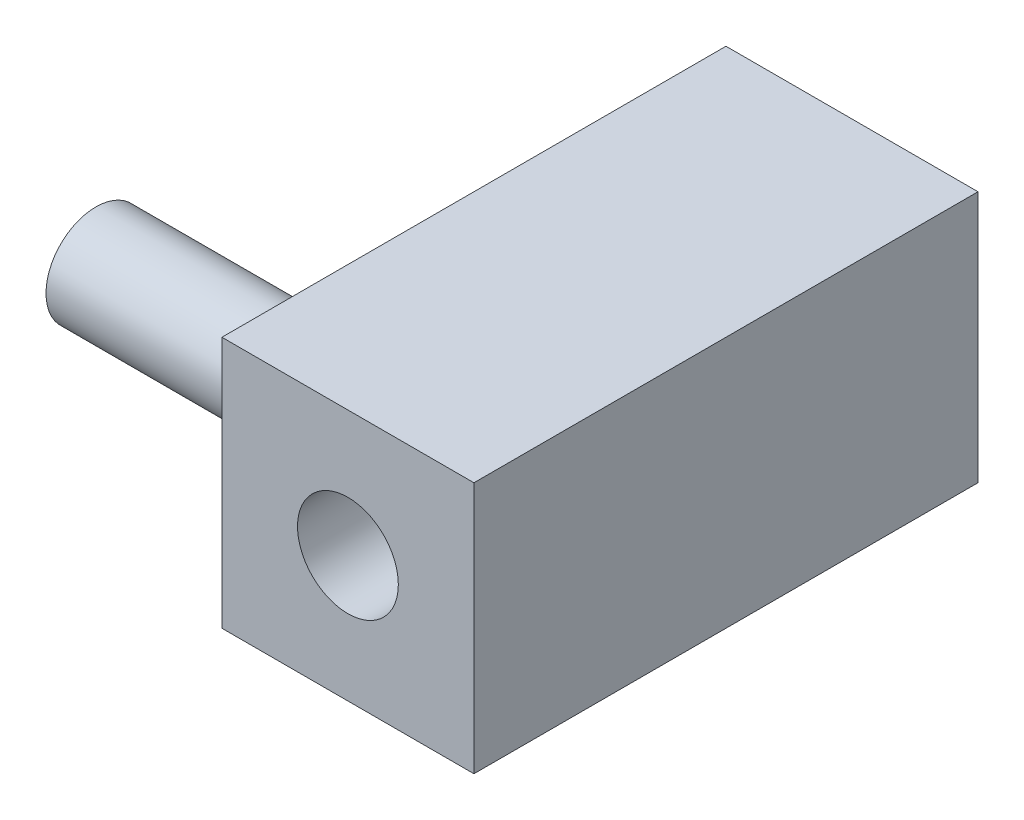
from build123d import *

# Parameters (mm, degrees)
SKETCH1_W           = 50
SKETCH1_H           = 50
BOSS_EXTRUDE1_DEPTH = 100
SKETCH2_R           = 9.9
BOSS_EXTRUDE2_DEPTH = 50
SKETCH3_R           = 10
CUT_EXTRUDE1_DEPTH  = 50


with BuildPart() as part:
    # Sketch1 → Boss-Extrude1 (new body)
    with BuildSketch(Plane.XY):
        with Locations((-25, 25)):
            Rectangle(SKETCH1_W, SKETCH1_H)
    extrude(amount=BOSS_EXTRUDE1_DEPTH)

    # Sketch2 → Boss-Extrude2 (add)
    with BuildSketch(Plane.ZY.offset(50)):
        with Locations(Location((75, 25, 0), (0, 0, 180))):
            Circle(SKETCH2_R)
    extrude(amount=BOSS_EXTRUDE2_DEPTH)

    # Sketch3 → Cut-Extrude1 (cut)
    with BuildSketch(Plane.XY.offset(100)):
        with Locations((-25, 25)):
            Circle(SKETCH3_R)
    extrude(amount=-CUT_EXTRUDE1_DEPTH, mode=Mode.SUBTRACT)


solid = part.part
